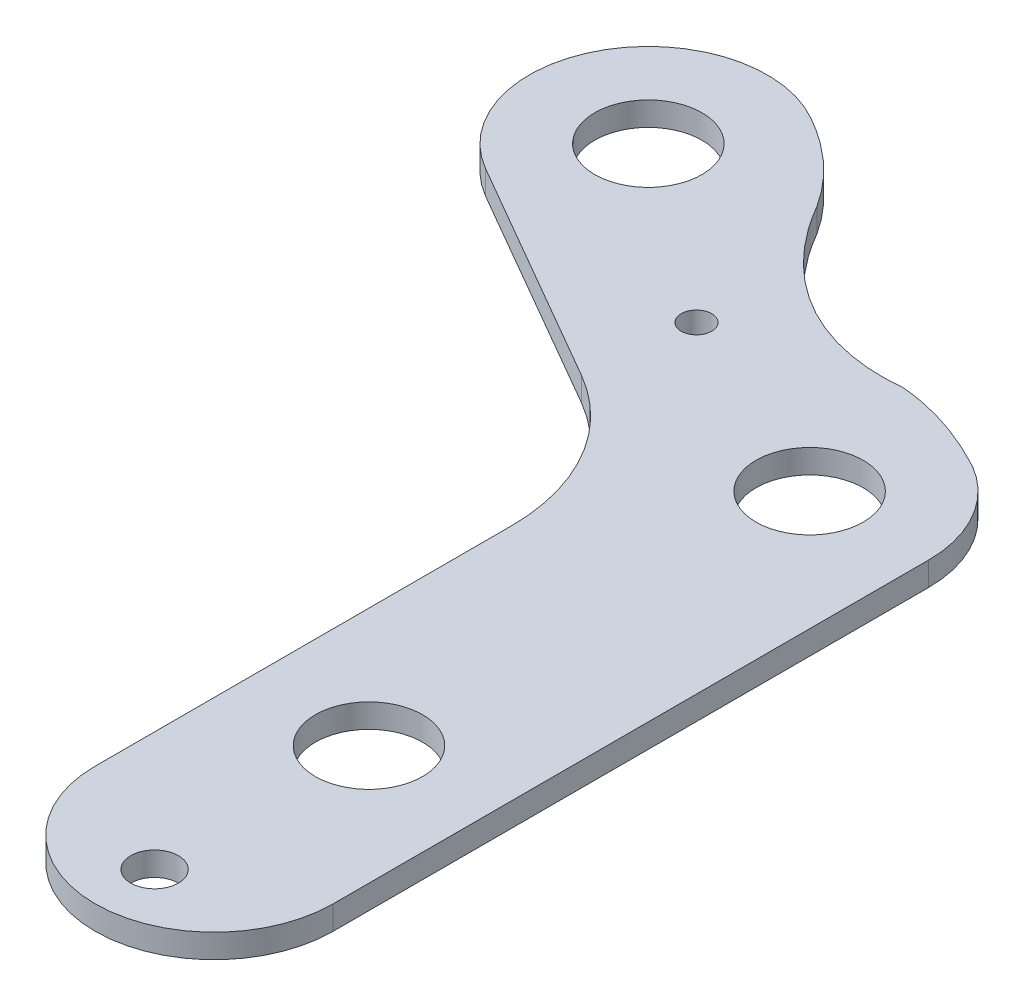
from build123d import *

# Parameters (mm, degrees)
SKETCH2_R           = 14.2875
SKETCH2_R_2         = 6.35
SKETCH2_R_3         = 4.064
BOSS_EXTRUDE1_DEPTH = 6.35


with BuildPart() as part:
    # Sketch2 → Boss-Extrude1 (new body)
    with BuildSketch(Plane(origin=(0, 0, 0), x_dir=(1, 0, 0), z_dir=(0, 1, 0))):
        with BuildLine():
            Line((31.75, 20.031971953), (31.75, 117.475))
            ThreePointArc((31.75, 117.475), (27.49630657, 133.35), (15.875, 144.97130657))
            add(Edge.make_bspline(
                [(-11.426385325, 153.835795689), (1.224450482, 152.855976047), (15.875, 144.97130657)],
                knots=[0, 0, 0, 1, 1, 1], degree=2))
            add(Edge.make_bspline(
                [(-64.783506655, 184.207168681), (-52.423507121, 162.771572898), (-33.18367174, 151.627706727), (-11.426385325, 153.835795689)],
                knots=[0, 0, 0, 0, 1, 1, 1, 1], degree=3))
            add(Edge.make_bspline(
                [(-85.86133431, 203.70880657), (-72.386286962, 196.104383794), (-64.783506655, 184.207168681)],
                knots=[0, 0, 0, 1, 1, 1], degree=2))
            ThreePointArc((-85.86133431, 203.70880657), (-129.23264088, 192.0875), (-117.61133431, 148.71619343))
            Line((-117.61133431, 148.71619343), (-57.15, 113.808825791))
            ThreePointArc((-57.15, 113.808825791), (-38.555909488, 95.214735278), (-31.75, 69.814735278))
            Line((-31.75, 69.814735278), (-31.75, -41.275))
            ThreePointArc((-31.75, -41.275), (0, -73.025), (31.75, -41.275))
            Line((31.75, -41.275), (31.75, 20.031971953))
        make_face()
        with Locations(Location((0, 0, 0), (0, 0, 270))):
            Circle(SKETCH2_R, mode=Mode.SUBTRACT)
        with Locations(Location((0, 117.475, 0), (0, 0, 270))):
            Circle(SKETCH2_R, mode=Mode.SUBTRACT)
        with Locations(Location((-101.73633431, 176.2125, 0), (0, 0, 270))):
            Circle(SKETCH2_R, mode=Mode.SUBTRACT)
        with Locations(Location((0, -57.15, 0), (0, 0, 270))):
            Circle(SKETCH2_R_2, mode=Mode.SUBTRACT)
        with Locations(Location((-54.043167155, 141.344488686, 0), (0, 0, 270))):
            Circle(SKETCH2_R_3, mode=Mode.SUBTRACT)
    extrude(amount=BOSS_EXTRUDE1_DEPTH)


solid = part.part
